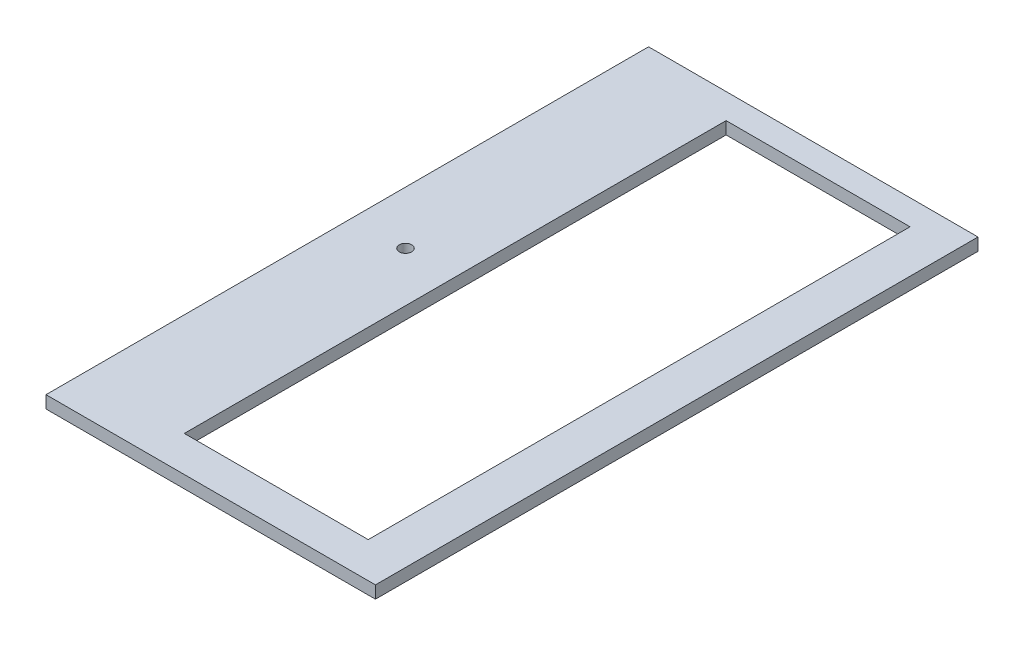
from build123d import *

# Parameters (mm, degrees)
BOSS_EXTRUDE1_DEPTH = 3.175
SKETCH2_R           = 1.5875
SKETCH2_W           = 80.264
SKETCH2_H           = 12.954
CUT_EXTRUDE1_DEPTH  = 223.985606318
SKETCH7_R           = 1.5875
SKETCH7_W           = 46.99
SKETCH7_H           = 138.43
CUT_EXTRUDE4_DEPTH  = 223.985606318
CUT_EXTRUDE5_DEPTH  = 223.985606318
CUT_EXTRUDE6_DEPTH  = 221.482742149
CUT_EXTRUDE7_DEPTH  = 221.482742149


with BuildPart() as part:
    # Sketch1 → Boss-Extrude1 (new body)
    with BuildSketch(Plane(origin=(0, 0, 0), x_dir=(1, 0, 0), z_dir=(0, 1, 0))):
        with BuildLine():
            Line((-80, 112.5), (100, 112.5))
            Line((100, 112.5), (100, -112.5))
            Line((100, -112.5), (-80, -112.5))
            ThreePointArc((-80, -112.5), (-192.5, 0), (-80, 112.5))
        make_face()
    extrude(amount=-BOSS_EXTRUDE1_DEPTH)

    # Sketch2 → Cut-Extrude1 (cut, through all)
    with BuildSketch(Plane(origin=(0, 0, 0), x_dir=(1, 0, 0), z_dir=(0, 1, 0))):
        with Locations(Location((36.144045702, -74.2188, 0), (0, 0, 270))):
            Circle(SKETCH2_R)
        with Locations(Location((36.144045702, -67.8688, 0), (0, 0, 270))):
            Circle(SKETCH2_R)
        with Locations(Location((36.144045702, -61.5188, 0), (0, 0, 270))):
            Circle(SKETCH2_R)
        with Locations(Location((36.144045702, -55.1688, 0), (0, 0, 270))):
            Circle(SKETCH2_R)
        with Locations(Location((36.144045702, -48.8188, 0), (0, 0, 270))):
            Circle(SKETCH2_R)
        with Locations(Location((36.144045702, -42.4688, 0), (0, 0, 270))):
            Circle(SKETCH2_R)
        with Locations(Location((36.144045702, -36.1188, 0), (0, 0, 270))):
            Circle(SKETCH2_R)
        with Locations(Location((67.894045702, -74.2188, 0), (0, 0, 270))):
            Circle(SKETCH2_R)
        with Locations(Location((67.894045702, -67.8688, 0), (0, 0, 270))):
            Circle(SKETCH2_R)
        with Locations(Location((67.894045702, -61.5188, 0), (0, 0, 270))):
            Circle(SKETCH2_R)
        with Locations(Location((67.894045702, -55.1688, 0), (0, 0, 270))):
            Circle(SKETCH2_R)
        with Locations(Location((67.894045702, -48.8188, 0), (0, 0, 270))):
            Circle(SKETCH2_R)
        with Locations(Location((67.894045702, -42.4688, 0), (0, 0, 270))):
            Circle(SKETCH2_R)
        with Locations(Location((67.894045702, -36.1188, 0), (0, 0, 270))):
            Circle(SKETCH2_R)
        with Locations(Location((36.144045702, 74.2188, 0), (0, 0, 270))):
            Circle(SKETCH2_R)
        with Locations(Location((36.144045702, 67.8688, 0), (0, 0, 270))):
            Circle(SKETCH2_R)
        with Locations(Location((36.144045702, 61.5188, 0), (0, 0, 270))):
            Circle(SKETCH2_R)
        with Locations(Location((36.144045702, 55.1688, 0), (0, 0, 270))):
            Circle(SKETCH2_R)
        with Locations(Location((36.144045702, 48.8188, 0), (0, 0, 270))):
            Circle(SKETCH2_R)
        with Locations(Location((36.144045702, 42.4688, 0), (0, 0, 270))):
            Circle(SKETCH2_R)
        with Locations(Location((36.144045702, 36.1188, 0), (0, 0, 270))):
            Circle(SKETCH2_R)
        with Locations(Location((67.894045702, 74.2188, 0), (0, 0, 270))):
            Circle(SKETCH2_R)
        with Locations(Location((67.894045702, 67.8688, 0), (0, 0, 270))):
            Circle(SKETCH2_R)
        with Locations(Location((67.894045702, 61.5188, 0), (0, 0, 270))):
            Circle(SKETCH2_R)
        with Locations(Location((67.894045702, 55.1688, 0), (0, 0, 270))):
            Circle(SKETCH2_R)
        with Locations(Location((67.894045702, 48.8188, 0), (0, 0, 270))):
            Circle(SKETCH2_R)
        with Locations(Location((67.894045702, 42.4688, 0), (0, 0, 270))):
            Circle(SKETCH2_R)
        with Locations(Location((67.894045702, 36.1188, 0), (0, 0, 270))):
            Circle(SKETCH2_R)
        with Locations((52.019045702, -96.4438)):
            Rectangle(SKETCH2_W, SKETCH2_H)
        with Locations((52.019045702, 96.4438)):
            Rectangle(SKETCH2_W, SKETCH2_H)
    extrude(amount=-CUT_EXTRUDE1_DEPTH, mode=Mode.SUBTRACT)

    # Sketch7 → Cut-Extrude4 (cut, through all)
    with BuildSketch(Plane(origin=(0, 0, 0), x_dir=(1, 0, 0), z_dir=(0, 1, 0))):
        with Locations(Location((-50.166143469, 0, 0), (0, 0, 270))):
            Circle(SKETCH7_R)
        with Locations(Location((25.582761582, 0, 0), (0, 0, 270))):
            Circle(SKETCH7_R)
        with Locations(Location((87.462148806, 0, 0), (0, 0, 270))):
            Circle(SKETCH7_R)
        with Locations((-13.971143469, 0)):
            Rectangle(SKETCH7_W, SKETCH7_H)
    extrude(amount=-CUT_EXTRUDE4_DEPTH, mode=Mode.SUBTRACT)

    # Sketch8 → Cut-Extrude5 (cut, through all)
    with BuildSketch(Plane(origin=(0, 0, 0), x_dir=(1, 0, 0), z_dir=(0, 1, 0))):
        with BuildLine():
            Line((-167.0966, 25.4), (-229.776686608, 25.4))
            Line((-229.776686608, 25.4), (-229.776686608, -25.4))
            Line((-229.776686608, -25.4), (-167.0966, -25.4))
            ThreePointArc((-167.0966, -25.4), (-141.6966, 0), (-167.0966, 25.4))
        make_face()
    extrude(amount=-CUT_EXTRUDE5_DEPTH, mode=Mode.SUBTRACT)

    # Sketch9 → Cut-Extrude6 (cut, through all)
    with BuildSketch(Plane(origin=(0, 0, 0), x_dir=(1, 0, 0), z_dir=(0, 1, 0))):
        Polygon((0, 120.924498436), (0, 78.840642152), (20.45905334, 78.840642152), (20.45905334, -78.840642152), (0, -78.840642152), (0, -122.522619561), (114.748199697, -122.522619561), (114.748199697, 120.924498436), align=None)
    extrude(amount=-CUT_EXTRUDE6_DEPTH, mode=Mode.SUBTRACT)

    # Sketch10 → Cut-Extrude7 (cut, through all)
    with BuildSketch(Plane(origin=(0, 0, 0), x_dir=(1, 0, 0), z_dir=(0, 1, 0))):
        Polygon((24.720709672, 75.644399903), (-63.708659228, 75.644399903), (-63.708659228, -78.30793511), (24.720709672, -78.30793511), (24.720709672, -86.831247776), (24.720709672, -123.055326602), (-234.174912529, -128.382397018), (-239.283531036, 119.896462399), (24.720709672, 119.896462399), align=None)
    extrude(amount=-CUT_EXTRUDE7_DEPTH, mode=Mode.SUBTRACT)


solid = part.part
